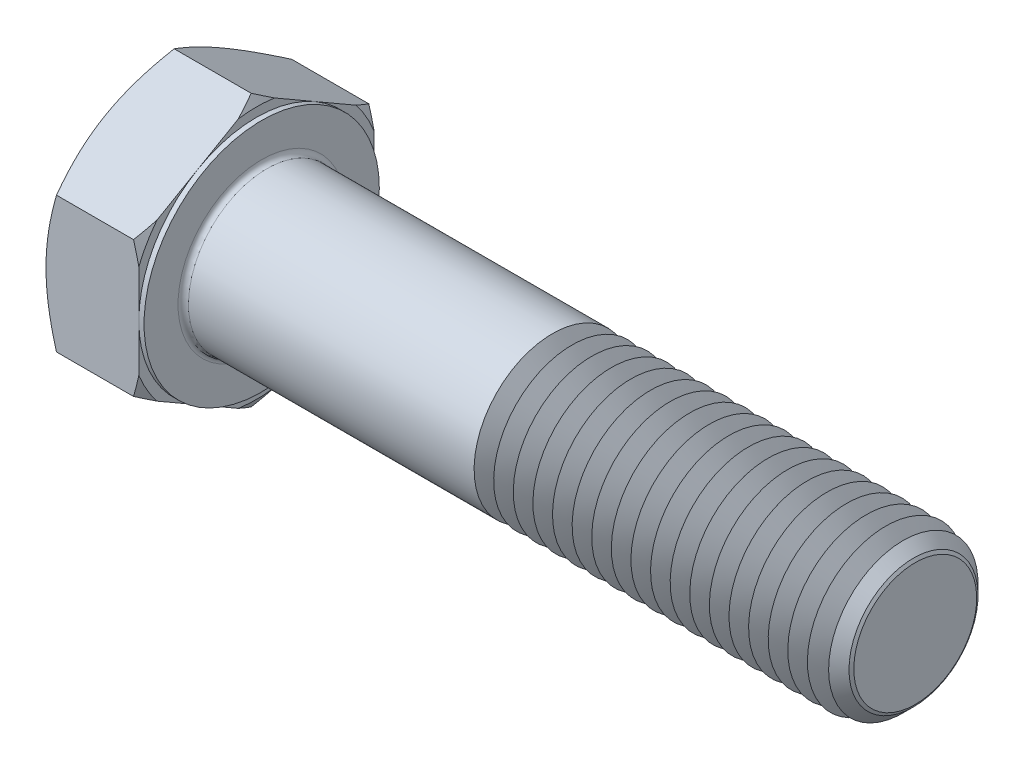
from build123d import *

# Parameters (mm, degrees)
EXTRUDE_389_DEPTH      = 15
SKETCH_4_W             = 0.8
SKETCH_4_H             = 12.784609691
CHAMFER_2089_SIZE      = 2.4
FILLET_2131_R          = 0.8
PATTERN_LINEAR_1_COUNT = 19
PATTERN_LINEAR_1_PITCH = 3


with BuildPart() as part:
    # 草图1 → Extrude 389 (new body)
    with BuildSketch(Plane(origin=(0, 0, 0), x_dir=(0, 0, -1), z_dir=(1, 0, 0))):
        Polygon((18, 10.392304845), (18, -10.392304845), (0, -20.784609691), (-18, -10.392304845), (-18, 10.392304845), (0, 20.784609691), align=None)
    extrude(amount=EXTRUDE_389_DEPTH)

    # 草图2 → 凸台-旋转1 (revolve)
    with BuildSketch(Plane.XY, mode=Mode.PRIVATE) as revolve_1_sk:
        Polygon((0, 0), (115, 0), (115, 9.402), (115, 12), (27.8072, 12), (0, 12), align=None)
    revolve(revolve_1_sk.sketch.rotate(Axis((0, 0, 0), (1, 0, 0)), 90), axis=Axis((0, 0, 0), (1, 0, 0)))

    # 草图3 → 切除-旋转1 (revolve, cut)
    with BuildSketch(Plane.XY):
        Polygon((0, 18), (4.494446501, 25.784609691), (4.494446501, 30.784609691), (-10, 30.784609691), (-10, 18), align=None)
    revolve(axis=Axis((0, 0, 0), (1, 0, 0)), mode=Mode.SUBTRACT)

    # 草图5 → 切除-旋转2 (revolve, cut)
    with BuildSketch(Plane.XY):
        Polygon((15, 18), (10.505553499, 25.784609691), (10.505553499, 30.784609691), (20.505553499, 30.784609691), (20.505553499, 18), align=None)
    revolve(axis=Axis((0, 0, 0), (1, 0, 0)), mode=Mode.SUBTRACT)

    # 草图4 → 切除-旋转3 (revolve, cut)
    with BuildSketch(Plane.XY, mode=Mode.PRIVATE) as cut_revolve_3_sk:
        with Locations((14.6, 24.392304845)):
            Rectangle(SKETCH_4_W, SKETCH_4_H)
    revolve(cut_revolve_3_sk.sketch.rotate(Axis((0, 0, 0), (1, 0, 0)), 270), axis=Axis((0, 0, 0), (1, 0, 0)), mode=Mode.SUBTRACT)

    # Chamfer 2089
    chamfer_2089_edges = [part.edges().sort_by_distance(p)[0] for p in [
        (115, 0, -12),
    ]]
    chamfer(chamfer_2089_edges, length=CHAMFER_2089_SIZE)

    # Fillet 2131
    fillet_2131_edges = [part.edges().sort_by_distance(p)[0] for p in [
        (15, 0, -12),
    ]]
    fillet(fillet_2131_edges, radius=FILLET_2131_R)

    # 草图6 → 切除-旋转4 (revolve, cut)
    with BuildSketch(Plane.XY):
        Polygon((61, -9.402), (59.500044001, -12), (59.500044001, -15), (62.499955999, -15), (62.499955999, -12), align=None)
    cut_revolve_4 = revolve(axis=Axis((-3.175, 0, 0), (1, 0, 0)), mode=Mode.SUBTRACT)

    # 阵列(线性)1: 切除-旋转4 ×19
    with Locations(*[(i * PATTERN_LINEAR_1_PITCH, 0, 0) for i in range(1, PATTERN_LINEAR_1_COUNT)]):
        add(cut_revolve_4, mode=Mode.SUBTRACT)


solid = part.part
